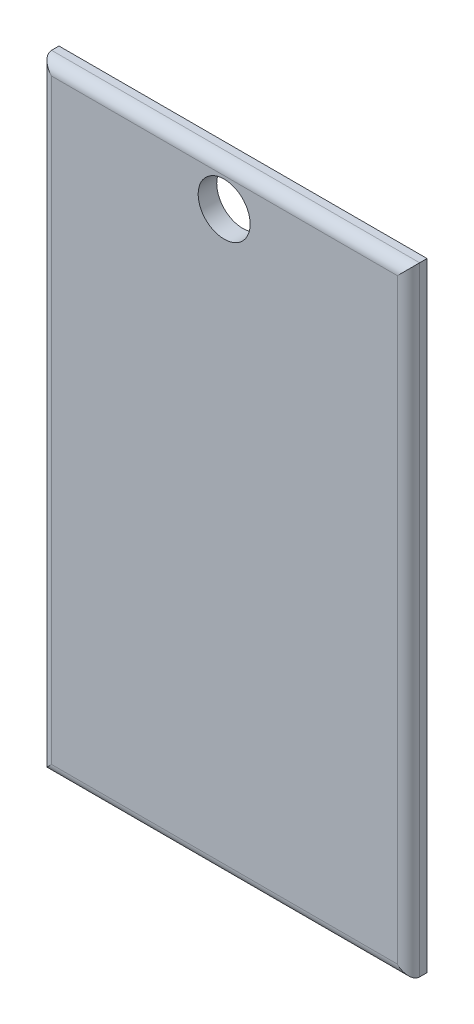
from build123d import *

# Parameters (mm, degrees)
ESBO_O1_W                = 99.1
ESBO_O1_H                = 166.52
RESSALTO_EXTRUS_O1_DEPTH = 5
FILETE1_R                = 3
ESBO_O2_R                = 3.1
CORTE_EXTRUS_O1_DEPTH    = 1.6
ESBO_O3_R                = 3.1
CORTE_EXTRUS_O2_DEPTH    = 1.6
ESBO_O4_R                = 3.1
CORTE_EXTRUS_O3_DEPTH    = 1.6
ESBO_O5_R                = 3.1
CORTE_EXTRUS_O4_DEPTH    = 1.6
ESBO_O6_R                = 7
CORTE_EXTRUS_O5_DEPTH    = 10


with BuildPart() as part:
    # Esboço1 → Ressalto-extrusão1 (new body)
    with BuildSketch(Plane.XY):
        with Locations((5.497464185, 11.397762804)):
            Rectangle(ESBO_O1_W, ESBO_O1_H)
    extrude(amount=RESSALTO_EXTRUS_O1_DEPTH)

    # Filete1
    filete1_edges = [part.edges().sort_by_distance(p)[0] for p in [
        (55.047464185, 11.397762804, 5),
        (5.497464185, 94.657762804, 5),
        (-44.052535815, 11.397762804, 5),
        (5.497464185, -71.862237196, 5),
    ]]
    fillet(filete1_edges, radius=FILETE1_R)

    # Esboço2 → Corte-extrusão1 (cut)
    with BuildSketch(Plane(origin=(0, 0, 0), x_dir=(-1, 0, 0), z_dir=(0, 0, -1))):
        with Locations((-51.497464185, 91.107762804)):
            Circle(ESBO_O2_R)
    extrude(amount=-CORTE_EXTRUS_O1_DEPTH, mode=Mode.SUBTRACT)

    # Esboço3 → Corte-extrusão2 (cut)
    with BuildSketch(Plane(origin=(0, 0, 0), x_dir=(-1, 0, 0), z_dir=(0, 0, -1))):
        with Locations((40.502535815, 91.107762804)):
            Circle(ESBO_O3_R)
    extrude(amount=-CORTE_EXTRUS_O2_DEPTH, mode=Mode.SUBTRACT)

    # Esboço4 → Corte-extrusão3 (cut)
    with BuildSketch(Plane(origin=(0, 0, 0), x_dir=(-1, 0, 0), z_dir=(0, 0, -1))):
        with Locations((-51.497464185, -68.312237196)):
            Circle(ESBO_O4_R)
    extrude(amount=-CORTE_EXTRUS_O3_DEPTH, mode=Mode.SUBTRACT)

    # Esboço5 → Corte-extrusão4 (cut)
    with BuildSketch(Plane(origin=(0, 0, 0), x_dir=(-1, 0, 0), z_dir=(0, 0, -1))):
        with Locations((40.502535815, -68.312237196)):
            Circle(ESBO_O5_R)
    extrude(amount=-CORTE_EXTRUS_O4_DEPTH, mode=Mode.SUBTRACT)

    # Esboço6 → Corte-extrusão5 (cut)
    with BuildSketch(Plane(origin=(0, 0, 0), x_dir=(-1, 0, 0), z_dir=(0, 0, -1))):
        with Locations((-5.41867497, 83.857762804)):
            Circle(ESBO_O6_R)
    extrude(amount=-CORTE_EXTRUS_O5_DEPTH, mode=Mode.SUBTRACT)


solid = part.part
